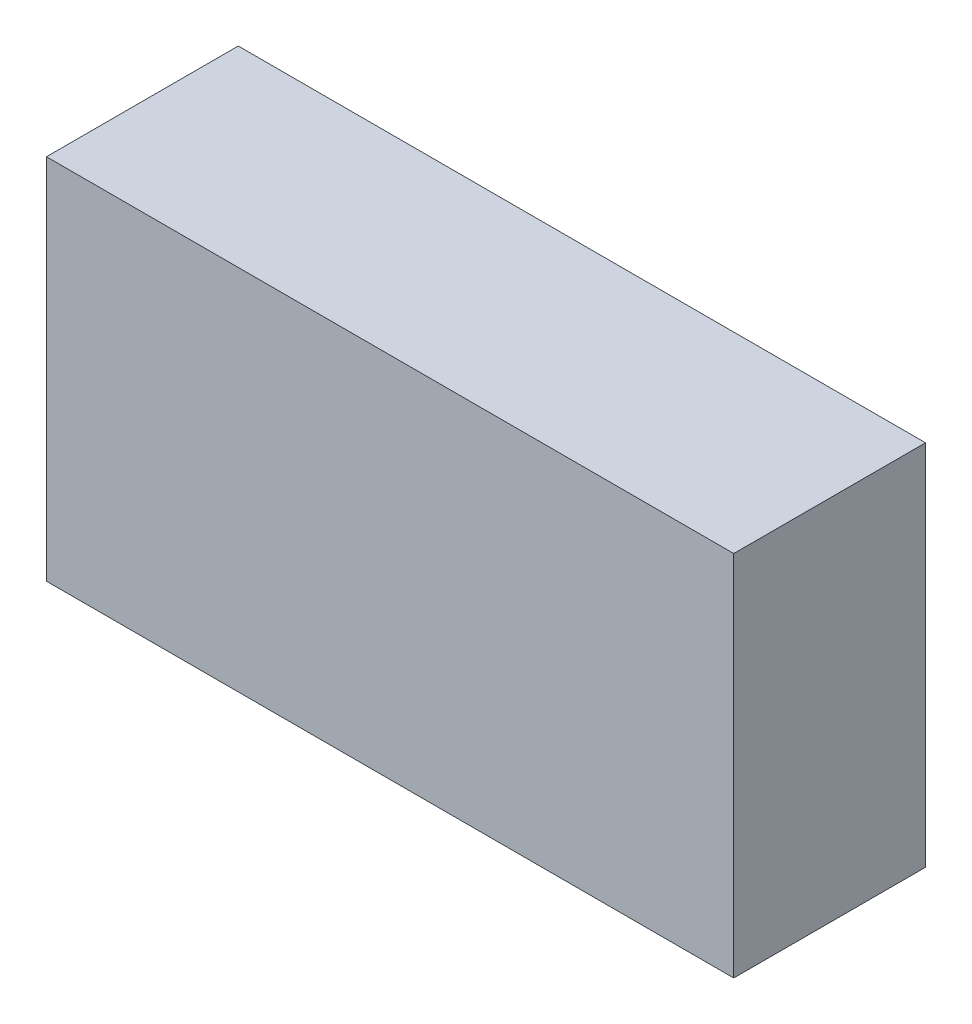
from build123d import *

# Parameters (mm, degrees)
SKETCH1_W           = 54.61
SKETCH1_H           = 29.21
BOSS_EXTRUDE1_DEPTH = 15.24


with BuildPart() as part:
    # Sketch1 → Boss-Extrude1 (new body)
    with BuildSketch(Plane.XY):
        with Locations((27.305, 14.605)):
            Rectangle(SKETCH1_W, SKETCH1_H)
    extrude(amount=BOSS_EXTRUDE1_DEPTH)


solid = part.part
